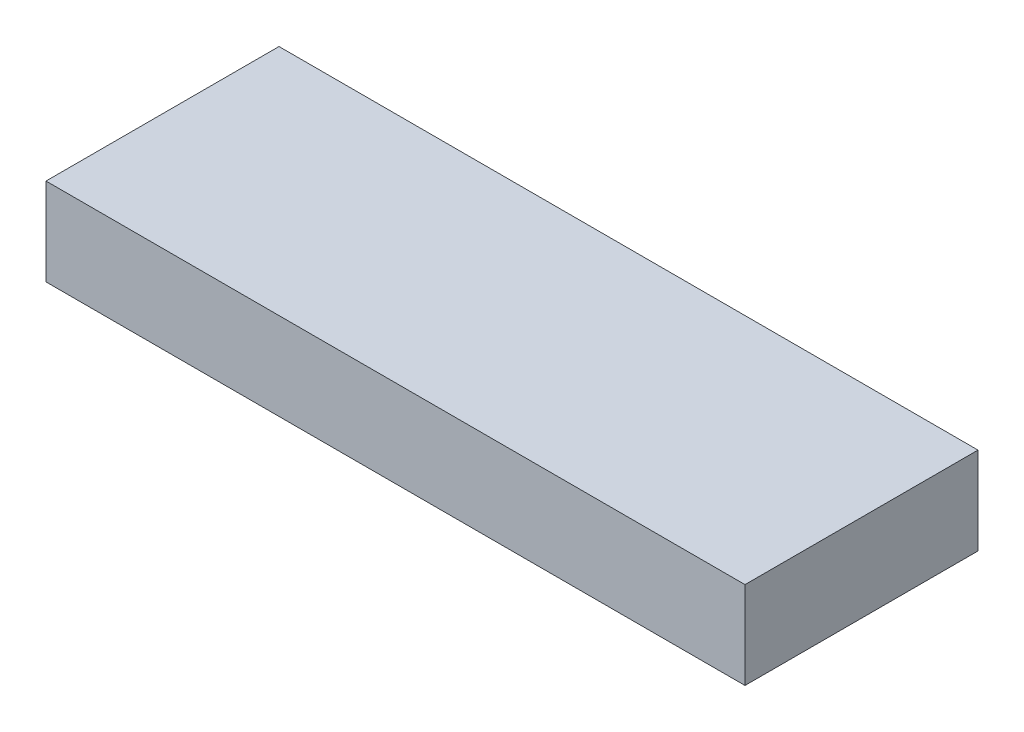
from build123d import *

# Parameters (mm, degrees)
SKETCH1_W           = 12
SKETCH1_H           = 4
BOSS_EXTRUDE1_DEPTH = 1.5


with BuildPart() as part:
    # Sketch1 → Boss-Extrude1 (new body)
    with BuildSketch(Plane(origin=(0, 0, 0), x_dir=(1, 0, 0), z_dir=(0, 1, 0))):
        with Locations((1.911504425, 0.415929204)):
            Rectangle(SKETCH1_W, SKETCH1_H)
    extrude(amount=BOSS_EXTRUDE1_DEPTH)


solid = part.part
